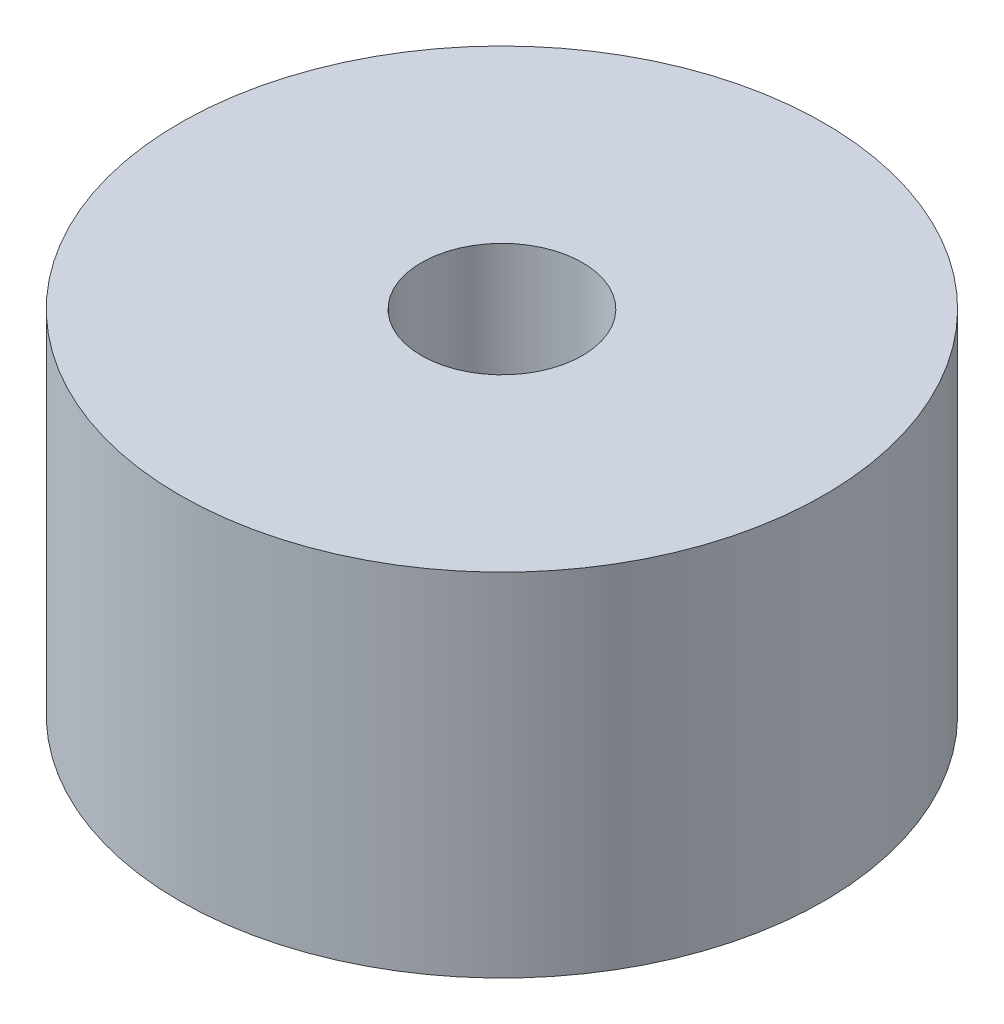
from build123d import *

# Parameters (mm, degrees)
SKETCH1_R           = 5.5
SKETCH1_R_2         = 1.375
BOSS_EXTRUDE1_DEPTH = 6


with BuildPart() as part:
    # Sketch1 → Boss-Extrude1 (new body)
    with BuildSketch(Plane(origin=(0, 0, 0), x_dir=(1, 0, 0), z_dir=(0, 1, 0))):
        with Locations(Location((0, 0, 0), (0, 0, 270))):
            Circle(SKETCH1_R)
        with Locations(Location((0, 0, 0), (0, 0, 270))):
            Circle(SKETCH1_R_2, mode=Mode.SUBTRACT)
    extrude(amount=BOSS_EXTRUDE1_DEPTH)


solid = part.part
